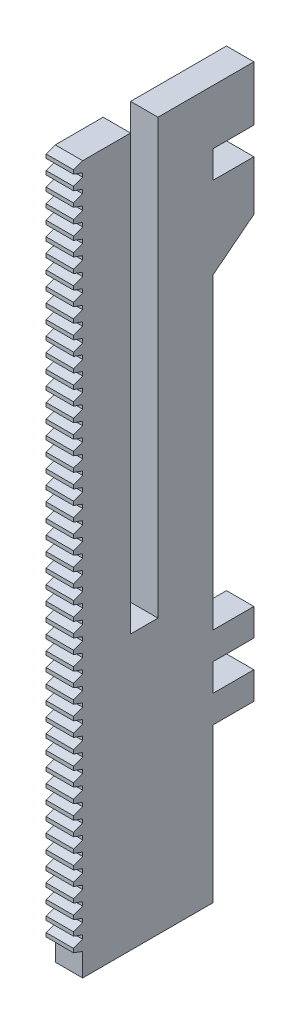
from build123d import *

# Parameters (mm, degrees)
BOSS_EXTRUDE1_DEPTH = 6


with BuildPart() as part:
    # Sketch1 → Boss-Extrude1 (new body)
    with BuildSketch(Plane(origin=(0, 0, 0), x_dir=(0, 0, -1), z_dir=(1, 0, 0))):
        Polygon((-13.492059495, 63.691685761), (-15.492063521, 62.963743827), (-15.492063521, 62.120886827), (-13.492059495, 61.392944893), (-13.492059495, 60.550087893), (-15.492063521, 59.822158827), (-15.492063521, 58.979301827), (-13.492059495, 58.251359893), (-13.492059495, 57.408502893), (-15.492063521, 56.680573827), (-15.492063521, 55.837716827), (-13.492059495, 55.109774893), (-13.492059495, 54.266917893), (-15.492063521, 53.538988827), (-15.492063521, 52.696131827), (-13.492059495, 51.968189893), (-13.492059495, 51.125332893), (-15.492063521, 50.397403827), (-15.492063521, 49.554546827), (-13.492059495, 48.826604893), (-13.492059495, 47.983747893), (-15.492063521, 47.255818827), (-15.492063521, 46.412961827), (-13.492059495, 45.685019893), (-13.492059495, 44.842162893), (-15.492063521, 44.114233827), (-15.492063521, 43.271376827), (-13.492059495, 42.543434893), (-13.492059495, 41.700577893), (-15.492063521, 40.972648827), (-15.492063521, 40.129791827), (-13.492059495, 39.401849893), (-13.492059495, 38.558992893), (-15.492063521, 37.831063827), (-15.492063521, 36.988206827), (-13.492059495, 36.260264893), (-13.492059495, 35.417407893), (-15.492063521, 34.689478827), (-15.492063521, 33.846621827), (-13.492059495, 33.118679893), (-13.492059495, 32.275822893), (-15.492063521, 31.547893827), (-15.492063521, 30.705036827), (-13.492059495, 29.977094893), (-13.492059495, 29.134237893), (-15.492063521, 28.406308827), (-15.492063521, 27.563451827), (-13.492059495, 26.835509893), (-13.492059495, 25.992652893), (-15.492063521, 25.264723827), (-15.492063521, 24.421866827), (-13.492059495, 23.693924893), (-13.492059495, 22.851067893), (-15.492063521, 22.123138827), (-15.492063521, 21.280281827), (-13.492059495, 20.552339893), (-13.492059495, 19.709482893), (-15.492063521, 18.981553827), (-15.492063521, 18.138696827), (-13.492059495, 17.410754893), (-13.492059495, 16.567897893), (-15.492063521, 15.839968827), (-15.492063521, 14.997111827), (-13.492059495, 14.269169893), (-13.492059495, 13.426312893), (-15.492063521, 12.698383827), (-15.492063521, 11.855526827), (-13.492059495, 11.127584893), (-13.492059495, 10.284727893), (-15.492063521, 9.556798827), (-15.492063521, 8.713941827), (-13.492059495, 7.985999893), (-13.492059495, 7.143142893), (-15.492063521, 6.415213827), (-15.492063521, 5.572356827), (-13.492059495, 4.844414893), (-13.492059495, 4.001557893), (-15.492063521, 3.273628827), (-15.492063521, 2.430771827), (-13.492059495, 1.702829893), (-13.492059495, 0.859972893), (-15.492063521, 0.132043827), (-15.492063521, -0.710813173), (-13.492059495, -1.438755107), (-13.492059495, -2.281612107), (-15.492063521, -3.009541173), (-15.492063521, -3.852398173), (-13.492059495, -4.580340107), (-13.492059495, -5.423197107), (-15.492063521, -6.151126173), (-15.492063521, -6.993983173), (-13.492059495, -7.721925107), (-13.492059495, -8.564782107), (-15.492063521, -9.292711173), (-15.492063521, -10.135568173), (-13.492059495, -10.863510107), (-13.492059495, -11.706367107), (-15.492063521, -12.434296173), (-15.492063521, -13.277153173), (-13.492059495, -14.005095107), (-13.492059495, -14.847952107), (-15.492063521, -15.575881173), (-15.492063521, -16.418738173), (-13.492059495, -17.146680107), (-13.492059495, -17.989537107), (-15.492063521, -18.717466173), (-15.492063521, -19.560323173), (-13.492059495, -20.288265107), (-13.492059495, -21.131122107), (-15.492063521, -21.859051173), (-15.492063521, -22.701908173), (-13.492059495, -23.429850107), (-13.492059495, -24.272707107), (-15.492063521, -25.000636173), (-15.492063521, -25.843493173), (-13.492059495, -26.571435107), (-13.492059495, -27.414292107), (-15.492063521, -28.142221173), (-15.492063521, -28.985078173), (-13.492059495, -29.713020107), (-13.492059495, -30.555877107), (-15.492063521, -31.283806173), (-15.492063521, -32.126663173), (-13.492059495, -32.854605107), (-13.492059495, -33.697462107), (-15.492063521, -34.425391173), (-15.492063521, -35.268248173), (-13.492059495, -35.996190107), (-13.492059495, -36.839047107), (-15.492063521, -37.566976173), (-15.492063521, -38.409833173), (-13.492059495, -39.137775107), (-13.492059495, -39.980632107), (-15.492063521, -40.708561173), (-15.492063521, -41.551418173), (-13.492059495, -42.279360107), (-13.492059495, -43.122217107), (-15.492063521, -43.850146173), (-15.492063521, -44.693003173), (-13.492059495, -45.420945107), (-13.492059495, -46.263802107), (-15.492063521, -46.991731173), (-15.492063521, -47.834588173), (-13.492059495, -48.562530107), (-13.492059495, -49.405387107), (-15.492063521, -50.133316173), (-15.492063521, -50.976173173), (-13.492059495, -51.704115107), (-13.492059495, -52.546972107), (-15.492063521, -53.274901173), (-15.492063521, -54.117758173), (-13.492059495, -54.845700107), (-13.492059495, -55.688557107), (-15.492063521, -56.416486173), (-15.492063521, -57.259343173), (-13.492059495, -57.987285107), (-13.492059495, -58.830142107), (-15.492063521, -59.558071173), (-15.492063521, -60.400928173), (-13.492059495, -61.128870107), (-13.492059495, -61.971727107), (-15.492063521, -62.699656173), (-15.492063521, -63.542513173), (-13.492059495, -64.270455107), (-13.492059495, -65.113312107), (-15.492063521, -65.841241173), (-15.492063521, -66.684098173), (-13.492059495, -67.412040107), (-13.492059495, -68.254897107), (-15.492063521, -68.982826173), (-15.492063521, -69.825683173), (-13.492059495, -70.553625107), (-13.492059495, -71.396482107), (-15.492063521, -72.124411173), (-15.492063521, -72.967268173), (-13.492059495, -73.695210107), (-13.492059495, -74.538067107), (-15.492063521, -75.265996173), (-15.492063521, -76.108853173), (-13.492059495, -76.836795107), (-13.492059495, -77.679652107), (-15.492063521, -78.407581173), (-15.492063521, -79.250438173), (-13.492059495, -79.978380107), (-13.492059495, -80.821237107), (-15.492063521, -81.549166173), (-15.492063521, -82.392023173), (-13.492059495, -83.119965107), (-13.492059495, -83.962822107), (-15.492063521, -84.690751173), (-15.492063521, -85.533608173), (-13.492059495, -86.261550107), (-13.492059495, -87.104407107), (-13.492059495, -91.308314239), (15, -91.308314239), (15, -57.590599289), (24, -57.590599289), (24, -51.590599289), (15, -51.590599289), (15, -45.590599289), (24, -45.590599289), (24, -39.590599289), (15, -39.590599289), (15, 27.701559592), (24, 34.757178624), (24, 45.691685761), (15, 45.691685761), (15, 51.691685761), (24, 51.691685761), (24, 63.691685761), (15.861532468, 63.691685761), (3, 63.691685761), (3, -31.308314239), (-3, -31.308314239), (-3, 63.691685761), align=None)
    extrude(amount=BOSS_EXTRUDE1_DEPTH)


solid = part.part
